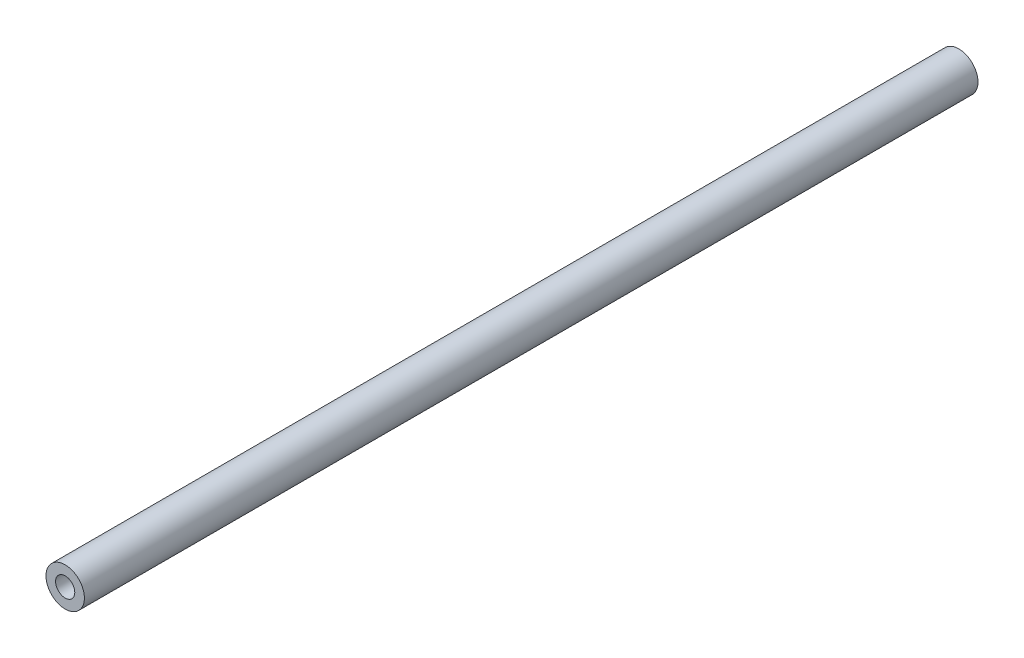
from build123d import *

# Parameters (mm, degrees)
CARBON_TUBE_REVB_START = -23.263326625
SKETCH1_R              = 1
SKETCH1_R_2            = 0.5
CARBON_TUBE_REVB_DEPTH = 46.52665325


with BuildPart() as part:
    # Sketch1 → Carbon_Tube_RevB (new body)
    with BuildSketch(Plane.XY.offset(CARBON_TUBE_REVB_START)):
        Circle(SKETCH1_R)
        Circle(SKETCH1_R_2, mode=Mode.SUBTRACT)
    extrude(amount=CARBON_TUBE_REVB_DEPTH)


solid = part.part
